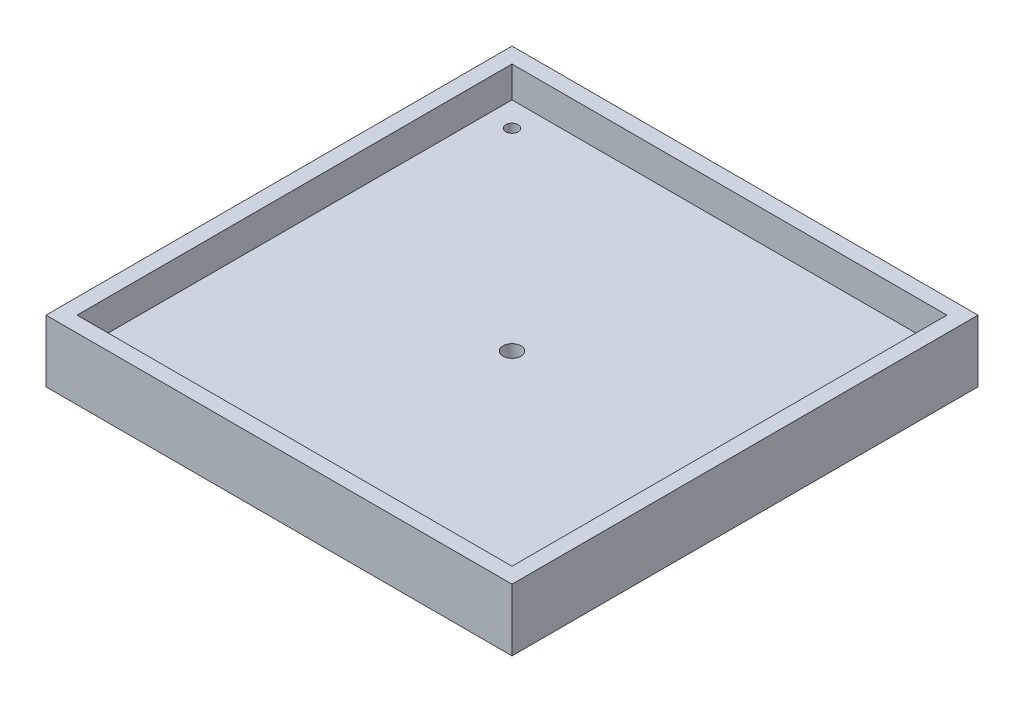
from build123d import *

# Parameters (mm, degrees)
SKETCH1_W           = 150
SKETCH1_H           = 150
SKETCH1_W_2         = 140
SKETCH1_H_2         = 140
BOSS_EXTRUDE1_DEPTH = 20
SKETCH1_3_W         = 140
SKETCH1_3_H         = 140
SKETCH1_3_R         = 2
BOSS_EXTRUDE2_DEPTH = 10
SKETCH1_4_R         = 57.5
CUT_EXTRUDE1_DEPTH  = 4
SKETCH1_5_R         = 2.9
CUT_EXTRUDE2_DEPTH  = 10


with BuildPart() as part:
    # Sketch1 → Boss-Extrude1 (new body)
    with BuildSketch(Plane(origin=(0, 0, 0), x_dir=(1, 0, 0), z_dir=(0, 1, 0))):
        Rectangle(SKETCH1_W, SKETCH1_H)
        Rectangle(SKETCH1_W_2, SKETCH1_H_2, mode=Mode.SUBTRACT)
    extrude(amount=BOSS_EXTRUDE1_DEPTH)

    # Sketch1<3> → Boss-Extrude2 (add)
    with BuildSketch(Plane(origin=(0, 0, 0), x_dir=(1, 0, 0), z_dir=(0, 1, 0))):
        Rectangle(SKETCH1_3_W, SKETCH1_3_H)
        with Locations(Location((-62.1, -62.1, 0), (0, 0, 270))):
            Circle(SKETCH1_3_R, mode=Mode.SUBTRACT)
        with Locations(Location((62.1, -62.1, 0), (0, 0, 270))):
            Circle(SKETCH1_3_R, mode=Mode.SUBTRACT)
        with Locations(Location((-62.1, 62.1, 0), (0, 0, 270))):
            Circle(SKETCH1_3_R, mode=Mode.SUBTRACT)
        with Locations(Location((62.1, 62.1, 0), (0, 0, 270))):
            Circle(SKETCH1_3_R, mode=Mode.SUBTRACT)
    extrude(amount=BOSS_EXTRUDE2_DEPTH)

    # Sketch1<4> → Cut-Extrude1 (cut)
    with BuildSketch(Plane(origin=(0, 0, 0), x_dir=(1, 0, 0), z_dir=(0, 1, 0))):
        with Locations(Location((0, 0, 0), (0, 0, 270))):
            Circle(SKETCH1_4_R)
    extrude(amount=CUT_EXTRUDE1_DEPTH, mode=Mode.SUBTRACT)

    # Sketch1<5> → Cut-Extrude2 (cut)
    with BuildSketch(Plane(origin=(0, 0, 0), x_dir=(1, 0, 0), z_dir=(0, 1, 0))):
        with Locations(Location((0, 0, 0), (0, 0, 270))):
            Circle(SKETCH1_5_R)
    extrude(amount=CUT_EXTRUDE2_DEPTH, mode=Mode.SUBTRACT)


solid = part.part
